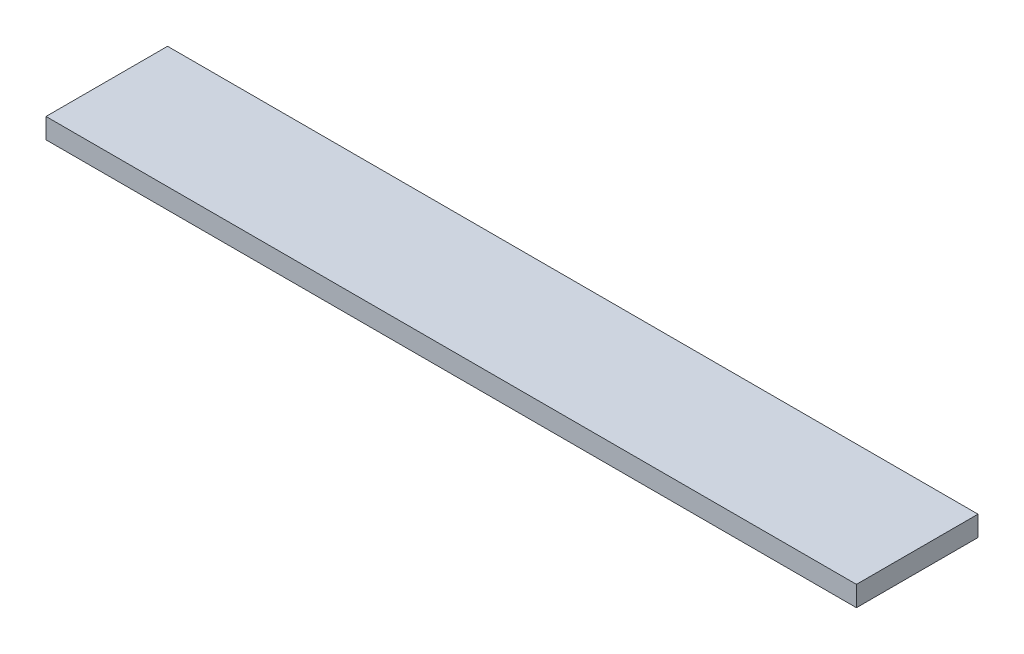
from build123d import *

# Parameters (mm, degrees)
SKETCH1_W             = 40
SKETCH1_H             = 6
BOSS_EXTRUDE1_DEPTH   = 1
BODY_MOVE_COPY1_ANGLE = 90


with BuildPart() as part:
    # Sketch1 → Boss-Extrude1 (new body)
    with BuildSketch(Plane.XY):
        with Locations((-7.311111111, 13.105555556)):
            Rectangle(SKETCH1_W, SKETCH1_H)
    extrude(amount=BOSS_EXTRUDE1_DEPTH)


with BuildPart() as part_1:
    # Body-Move/Copy1: moved
    add(part.part.rotate(Axis((0, 13.105555556, 0.25), (1, 0, 0)), BODY_MOVE_COPY1_ANGLE))


solid = part_1.part
